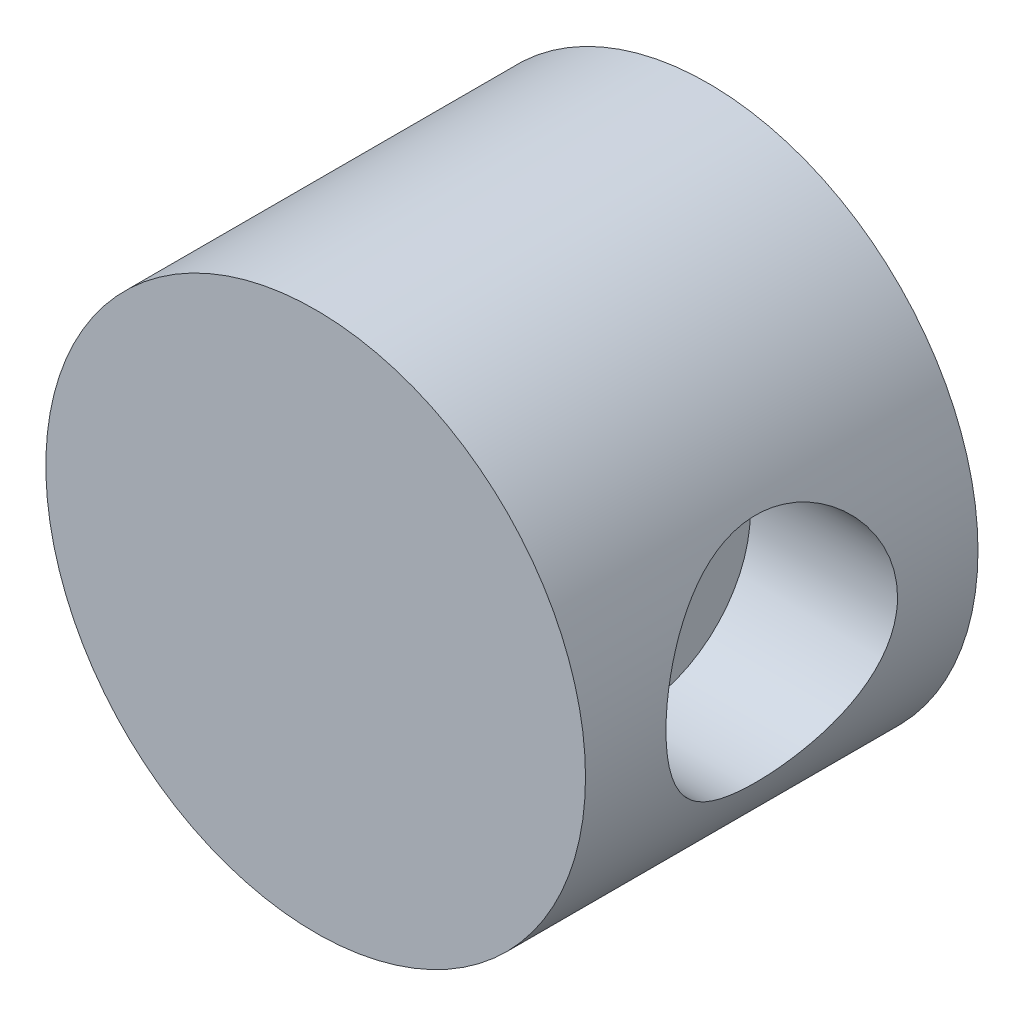
from build123d import *

# Parameters (mm, degrees)
CROQUIS1_R              = 27.5
SALIENTE_EXTRUIR1_DEPTH = 40
CROQUIS2_R              = 11.800520357
CORTAR_EXTRUIR1_DEPTH   = 15
CORTAR_EXTRUIR4_START   = 15
CROQUIS3_R              = 11.800520357
CORTAR_EXTRUIR4_DEPTH   = 15


with BuildPart() as part:
    # Croquis1 → Saliente-Extruir1 (new body)
    with BuildSketch(Plane.XY):
        Circle(CROQUIS1_R)
    extrude(amount=SALIENTE_EXTRUIR1_DEPTH)

    # Croquis2 → Cortar-Extruir1 (cut)
    with BuildSketch(Plane.ZY.offset(27.5)):
        with Locations((20, 0)):
            Circle(CROQUIS2_R)
    extrude(amount=-CORTAR_EXTRUIR1_DEPTH, mode=Mode.SUBTRACT)

    # Croquis3 → Cortar-Extruir4 (cut)
    with BuildSketch(Plane.ZY.offset(-27.5).offset(CORTAR_EXTRUIR4_START)):
        with Locations((20, 0)):
            Circle(CROQUIS3_R)
    extrude(amount=-CORTAR_EXTRUIR4_DEPTH, mode=Mode.SUBTRACT)


solid = part.part
